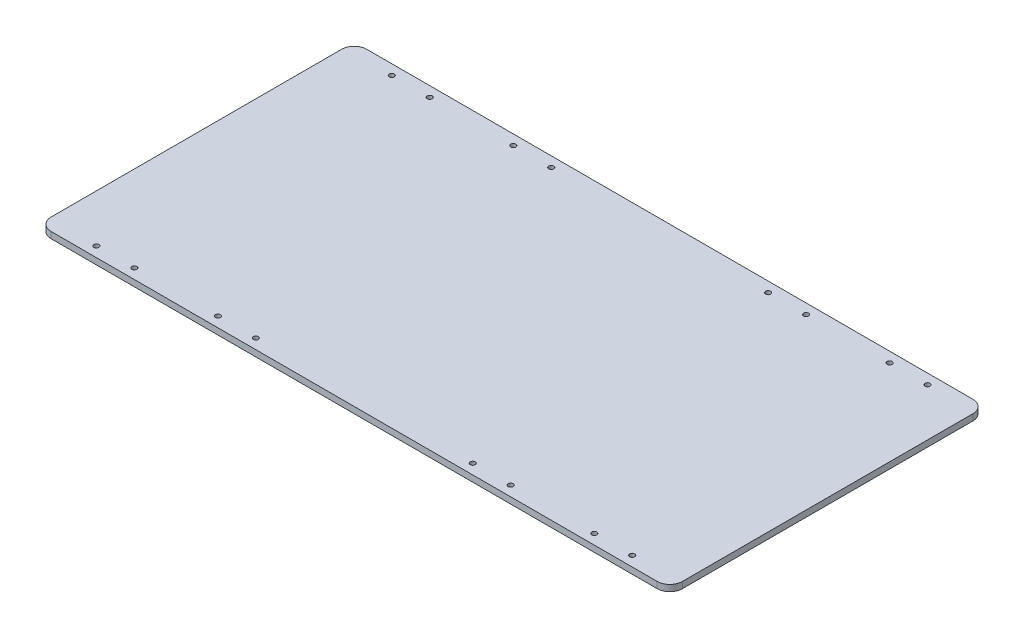
from build123d import *

# Parameters (mm, degrees)
SALIENTE_EXTRUIR1_DEPTH = 5
CROQUIS2_R              = 2
CORTAR_EXTRUIR1_DEPTH   = 10


with BuildPart() as part:
    # Croquis1 → Saliente-Extruir1 (new body)
    with BuildSketch(Plane(origin=(0, 0, 0), x_dir=(1, 0, 0), z_dir=(0, 1, 0))):
        with BuildLine():
            Line((240, -125), (-240, -125))
            ThreePointArc((-240, -125), (-247.071067812, -122.071067812), (-250, -115))
            Line((-250, -115), (-250, 115))
            ThreePointArc((-250, 115), (-247.071067812, 122.071067812), (-240, 125))
            Line((-240, 125), (240, 125))
            ThreePointArc((240, 125), (247.071067812, 122.071067812), (250, 115))
            Line((250, 115), (250, -115))
            ThreePointArc((250, -115), (247.071067812, -122.071067812), (240, -125))
        make_face()
    extrude(amount=SALIENTE_EXTRUIR1_DEPTH)

    # Croquis2 → Cortar-Extruir1 (cut)
    with BuildSketch(Plane(origin=(0, 5, 0), x_dir=(1, 0, 0), z_dir=(0, 1, 0))):
        with Locations(Location((-212.2, -116.98, 0), (0, 0, 270))):
            Circle(CROQUIS2_R)
        with Locations(Location((-182.15, -116.98, 0), (0, 0, 270))):
            Circle(CROQUIS2_R)
        with Locations(Location((-85.9, -116.98, 0), (0, 0, 270))):
            Circle(CROQUIS2_R)
        with Locations(Location((-115.95, -116.98, 0), (0, 0, 270))):
            Circle(CROQUIS2_R)
        with Locations(Location((212.2, -116.98, 0), (0, 0, 270))):
            Circle(CROQUIS2_R)
        with Locations(Location((182.15, -116.98, 0), (0, 0, 270))):
            Circle(CROQUIS2_R)
        with Locations(Location((115.95, -116.98, 0), (0, 0, 270))):
            Circle(CROQUIS2_R)
        with Locations(Location((85.9, -116.98, 0), (0, 0, 270))):
            Circle(CROQUIS2_R)
        with Locations(Location((212.2, 116.98, 0), (0, 0, 270))):
            Circle(CROQUIS2_R)
        with Locations(Location((182.15, 116.98, 0), (0, 0, 270))):
            Circle(CROQUIS2_R)
        with Locations(Location((115.95, 116.98, 0), (0, 0, 270))):
            Circle(CROQUIS2_R)
        with Locations(Location((85.9, 116.98, 0), (0, 0, 270))):
            Circle(CROQUIS2_R)
        with Locations(Location((-182.15, 116.98, 0), (0, 0, 270))):
            Circle(CROQUIS2_R)
        with Locations(Location((-212.2, 116.98, 0), (0, 0, 270))):
            Circle(CROQUIS2_R)
        with Locations(Location((-85.9, 116.98, 0), (0, 0, 270))):
            Circle(CROQUIS2_R)
        with Locations(Location((-115.95, 116.98, 0), (0, 0, 270))):
            Circle(CROQUIS2_R)
    extrude(amount=-CORTAR_EXTRUIR1_DEPTH, mode=Mode.SUBTRACT)


solid = part.part
